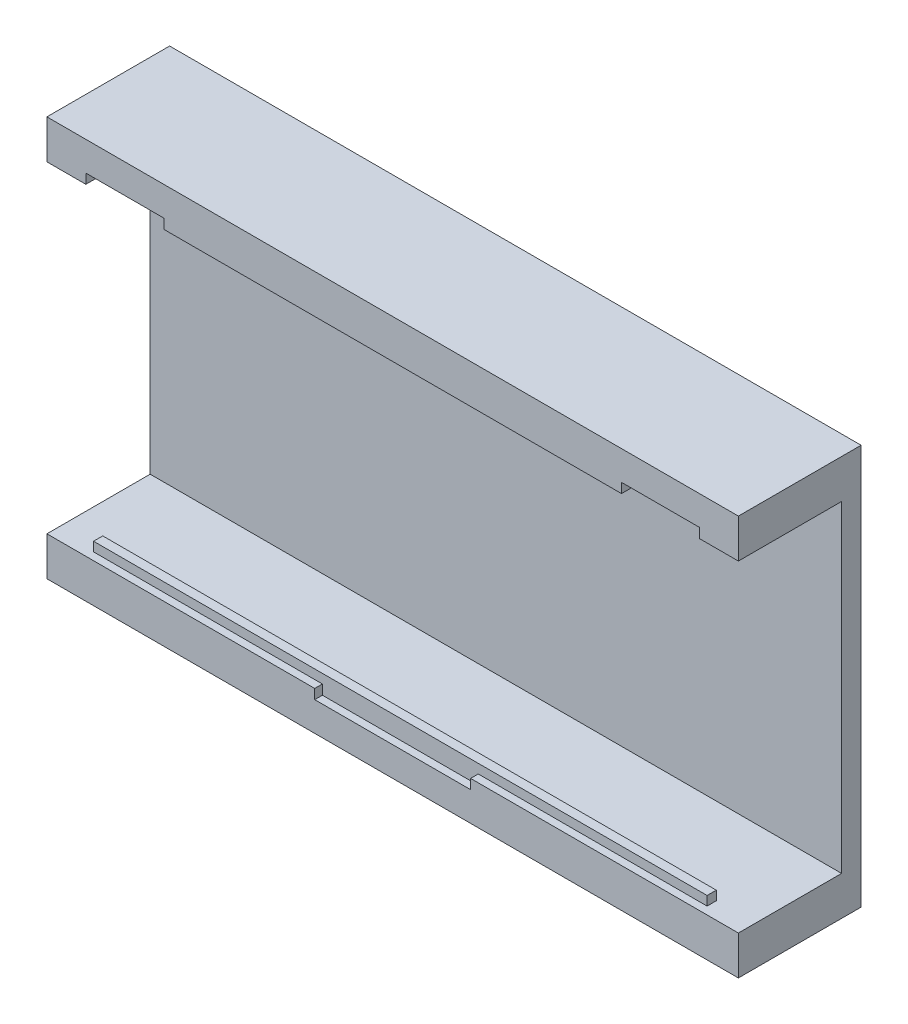
from build123d import *

# Parameters (mm, degrees)
SKETCH1_W            = 225.4
SKETCH1_H            = 130.4
SKETCH1_W_2          = 200
SKETCH1_H_2          = 105
EXTRUSION1_DEPTH     = 40
EXTRUSION2_REACH     = 169.793
SKETCH2_W            = 200
SKETCH2_H            = 6.35
EXTRUSION4_DEPTH     = 137.206938149
SKETCH4_W            = 7.5
SKETCH4_H            = 5
EXTRUSION5_DEPTH     = 227.036125431
EXTRUSION6_REACH     = 228.036
SKETCH5_W            = 3
SKETCH5_H            = 3
SKETCH6_W            = 50.8
SKETCH6_H            = 3.175
EXTRUSION7_DEPTH     = 2.5
SKETCH7_W            = 25.4
SKETCH7_H            = 3.175
EXTRUSION8_DEPTH     = 22.86
EXTRUSION9_DEPTH     = 168.793265657
SKETCH20_W           = 12.7
SKETCH20_H           = 105
CUT_EXTRUDE425_DEPTH = 33.65
BOSS_EXTRUDE4_REACH  = 141.323
SKETCH21_W           = 5.0038
SKETCH21_H           = 12.7


with BuildPart() as part:
    # Sketch1 → Extrusion1 (new body)
    with BuildSketch(Plane.XY):
        Rectangle(SKETCH1_W, SKETCH1_H)
        Rectangle(SKETCH1_W_2, SKETCH1_H_2, mode=Mode.SUBTRACT)
    extrude(amount=-EXTRUSION1_DEPTH)

    # Sketch2 → Extrusion2 (add, up to next)
    with BuildSketch(Plane.XZ.offset(-52.5), mode=Mode.PRIVATE) as extrusion2_sk1:
        with Locations((0, -36.825)):
            Rectangle(SKETCH2_W, SKETCH2_H)
    extrusion2_tool1 = extrude(extrusion2_sk1.sketch, amount=EXTRUSION2_REACH, mode=Mode.PRIVATE) - part.part
    add(extrusion2_tool1.solids().sort_by_distance((0, 52.5, -36.825))[0])

    # Sketch3 → Extrusion4 (cut, through all)
    with BuildSketch(Plane(origin=(0, 0, -40), x_dir=(-1, 0, 0), z_dir=(0, 0, -1))):
        with BuildLine():
            Line((2.5, 43.2), (2.5, 39.530127019))
            ThreePointArc((2.5, 39.530127019), (0, 30.2), (-2.5, 39.530127019))
            Line((-2.5, 39.530127019), (-2.5, 43.2))
            ThreePointArc((-2.5, 43.2), (0, 45.7), (2.5, 43.2))
        make_face()
    extrude(amount=-EXTRUSION4_DEPTH, mode=Mode.SUBTRACT)

    # Sketch4 → Extrusion5 (cut, through all)
    with BuildSketch(Plane.ZY.offset(-100)):
        with Locations((-29.9, -50)):
            Rectangle(SKETCH4_W, SKETCH4_H)
    extrude(amount=-EXTRUSION5_DEPTH, mode=Mode.SUBTRACT)

    # Sketch5 → Extrusion6 (add, up to next)
    with BuildSketch(Plane(origin=(-100, 0, 0), x_dir=(0, 0, -1), z_dir=(1, 0, 0)), mode=Mode.PRIVATE) as extrusion6_sk1:
        with Locations((4, -51)):
            Rectangle(SKETCH5_W, SKETCH5_H)
    extrusion6_tool1 = extrude(extrusion6_sk1.sketch, amount=EXTRUSION6_REACH, mode=Mode.PRIVATE) - part.part
    add(extrusion6_tool1.solids().sort_by_distance((-100, -51, -4))[0])

    # Sketch6 → Extrusion7 (cut)
    with BuildSketch(Plane.XY):
        with Locations((0, -54.0875)):
            Rectangle(SKETCH6_W, SKETCH6_H)
    extrude(amount=-EXTRUSION7_DEPTH, mode=Mode.SUBTRACT)

    # Sketch7 → Extrusion8 (cut)
    with BuildSketch(Plane.XY):
        with Locations((-87.3, 54.0875)):
            Rectangle(SKETCH7_W, SKETCH7_H)
    extrusion8 = extrude(amount=-EXTRUSION8_DEPTH, mode=Mode.SUBTRACT)

    # Mirror1: Extrusion8 across plane
    add(extrusion8.mirror(Plane(origin=(0, 0, 0), x_dir=(0, 0, 1), z_dir=(1, 0, 0))), mode=Mode.SUBTRACT)

    # Sketch8 → Extrusion9 (cut, through all)
    with BuildSketch(Plane(origin=(0, -52.5, 0), x_dir=(-1, 0, 0), z_dir=(0, 1, 0))):
        Polygon((0, -33.65), (3.7465, -33.65), (3.7465, -28.6462), (-3.7465, -28.6462), (-3.7465, -33.65), align=None)
    extrude(amount=-EXTRUSION9_DEPTH, mode=Mode.SUBTRACT)

    # Sketch20 → Cut-Extrude425 (cut)
    with BuildSketch(Plane.XY):
        with Locations((-106.35, 0)):
            Rectangle(SKETCH20_W, SKETCH20_H)
        with Locations((106.35, 0)):
            Rectangle(SKETCH20_W, SKETCH20_H)
    extrude(amount=-CUT_EXTRUDE425_DEPTH, mode=Mode.SUBTRACT)

    # Sketch21 → Boss-Extrude4 (add, up to next)
    with BuildSketch(Plane(origin=(-3.7465, 0, 0), x_dir=(0, 0, -1), z_dir=(1, 0, 0)), mode=Mode.PRIVATE) as boss_extrude4_sk1:
        with Locations((31.1481, -58.85)):
            Rectangle(SKETCH21_W, SKETCH21_H)
    boss_extrude4_tool1 = extrude(boss_extrude4_sk1.sketch, amount=BOSS_EXTRUDE4_REACH, mode=Mode.PRIVATE) - part.part
    add(boss_extrude4_tool1.solids().sort_by_distance((-3.7465, -58.85, -31.1481))[0])


solid = part.part
